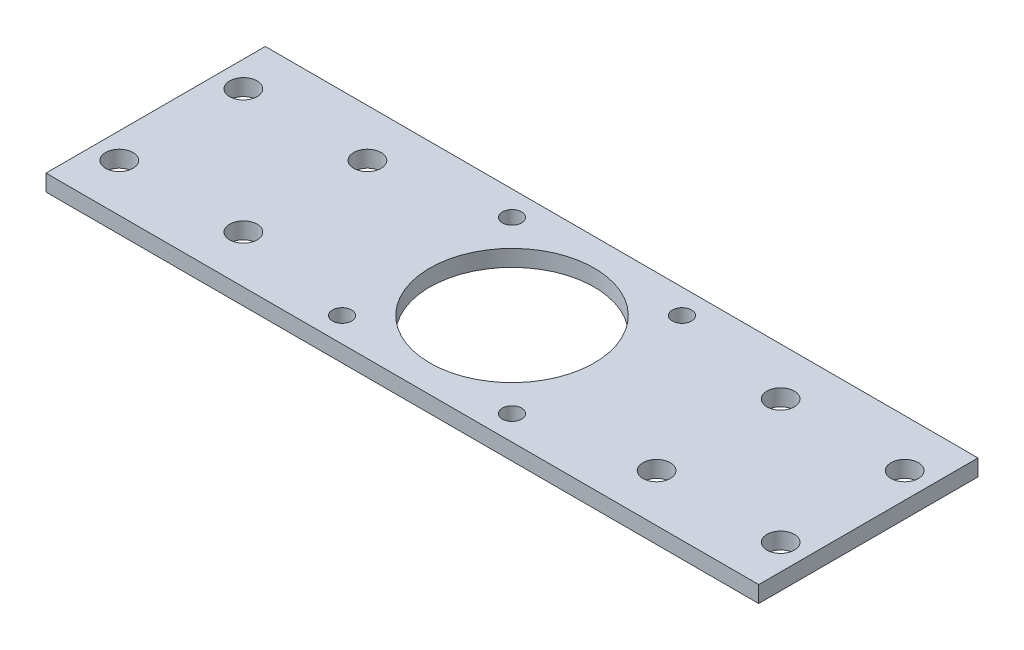
from build123d import *

# Parameters (mm, degrees)
SKETCH1_W                  = 130
SKETCH1_H                  = 40
BOSS_EXTRUDE1_DEPTH        = 3
SKETCH2_R                  = 15
CUT_EXTRUDE1_DEPTH         = 69.0734897
F_5_0_5_DIAMETER_HOLE1_D   = 5
F_3_5_3_5_DIAMETER_HOLE1_D = 3.5


with BuildPart() as part:
    # Sketch1 → Boss-Extrude1 (new body)
    with BuildSketch(Plane(origin=(0, 0, 0), x_dir=(1, 0, 0), z_dir=(0, 1, 0))):
        Rectangle(SKETCH1_W, SKETCH1_H)
    extrude(amount=BOSS_EXTRUDE1_DEPTH)

    # Sketch2 → Cut-Extrude1 (cut, through all)
    with BuildSketch(Plane(origin=(0, 0, 0), x_dir=(1, 0, 0), z_dir=(0, 1, 0))):
        with Locations(Location((0, 0, 0), (0, 0, 270))):
            Circle(SKETCH2_R)
    extrude(amount=CUT_EXTRUDE1_DEPTH, mode=Mode.SUBTRACT)

    # Ø5.0 (5) Diameter Hole1 (through all)
    with Locations(Plane(origin=(0, 0, 0), x_dir=(-1, 0, 0), z_dir=(0, -1, 0))):
        with Locations((60.313708499, 11.313708499), (60.313708499, -11.313708499), (37.686291501, -11.313708499), (37.686291501, 11.313708499)):
            f_5_0_5_diameter_hole1 = Hole(F_5_0_5_DIAMETER_HOLE1_D / 2)

    # Mirror1: Ø5.0 (5) Diameter Hole1 across plane
    add(f_5_0_5_diameter_hole1.mirror(Plane(origin=(0, 0, 0), x_dir=(0, 0, 1), z_dir=(1, 0, 0))), mode=Mode.SUBTRACT)

    # Ø3.5 (3.5) Diameter Hole1 (through all)
    with Locations(Plane(origin=(0, 0, 0), x_dir=(-1, 0, 0), z_dir=(0, -1, 0))):
        with Locations((0, 0), (-15.5, 15.5), (15.5, -15.5), (15.5, 15.5), (-15.5, -15.5)):
            Hole(F_3_5_3_5_DIAMETER_HOLE1_D / 2)


solid = part.part
